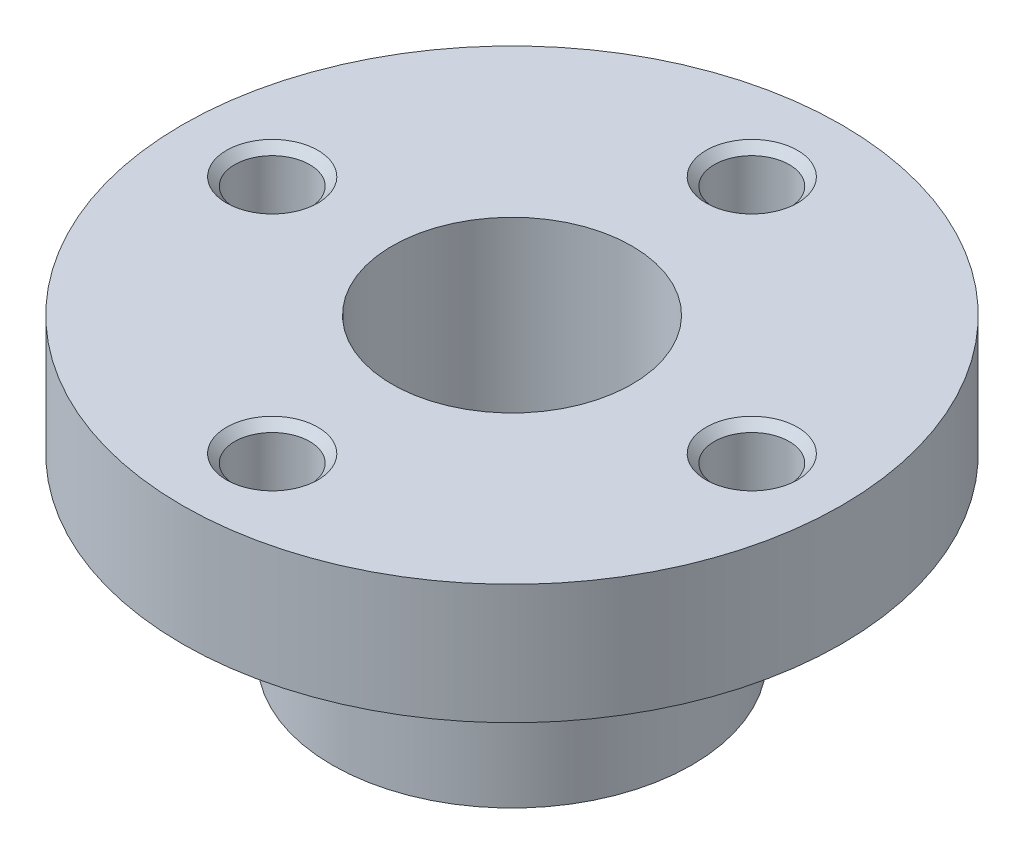
from build123d import *

# Parameters (mm, degrees)
M3X0_5_TAPPED_HOLE1_D           = 2.5
M3X0_5_TAPPED_HOLE1_CSINK_D     = 3.05
M3X0_5_TAPPED_HOLE1_CSINK_ANGLE = 90


with BuildPart() as part:
    # Sketch1 → Revolve1 (revolve)
    with BuildSketch(Plane.XY, mode=Mode.PRIVATE) as revolve1_sk:
        Polygon((4, 0), (4, 10), (11, 10), (11, 6), (6, 6), (6, 0), align=None)
    revolve(revolve1_sk.sketch.rotate(Axis((0, 0, 0), (0, 1, 0)), 90), axis=Axis((0, 0, 0), (0, 1, 0)))

    # M3x0.5 Tapped Hole1 (through all)
    with Locations(Plane(origin=(0, 10, 0), x_dir=(1, 0, 0), z_dir=(0, 1, 0))):
        with Locations((0, 8), (8, 0), (0, -8), (-8, 0), (0, 0)):
            CounterSinkHole(M3X0_5_TAPPED_HOLE1_D / 2, M3X0_5_TAPPED_HOLE1_CSINK_D / 2, counter_sink_angle=M3X0_5_TAPPED_HOLE1_CSINK_ANGLE)


solid = part.part
